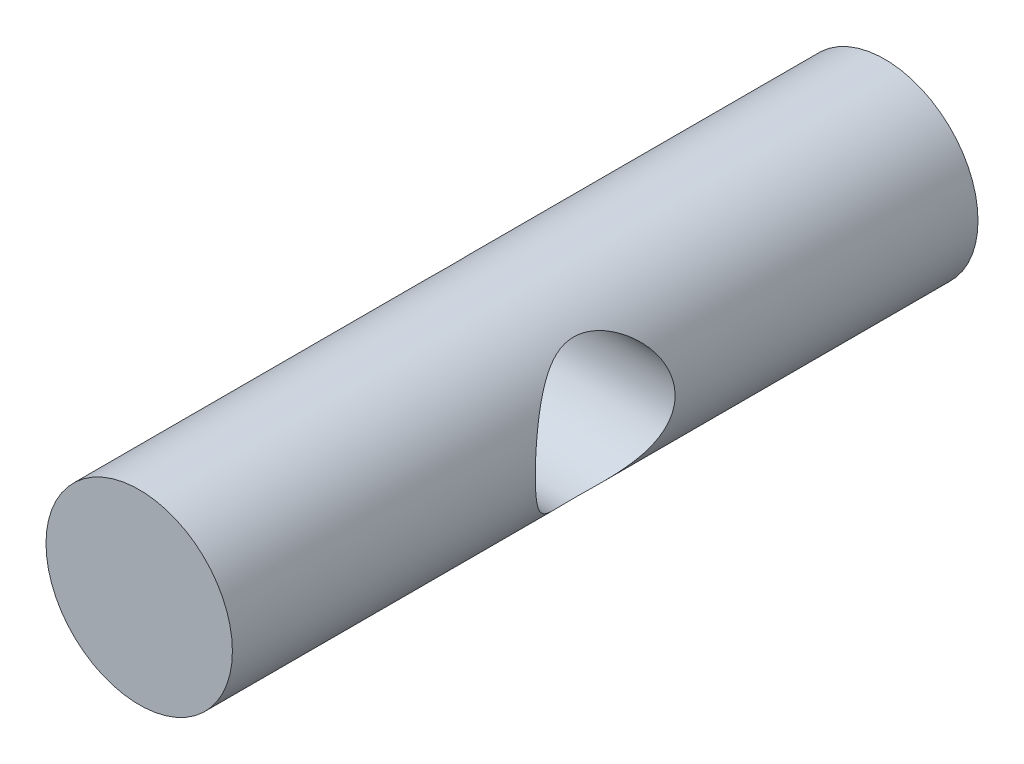
from build123d import *

# Parameters (mm, degrees)
SKETCH1_R               = 10
BOSS_EXTRUDE1_DEPTH     = 80
CUT_EXTRUDE1_DEPTH      = 13
CUT_EXTRUDE1_DEPTH_BACK = 14
SKETCH2_R               = 7.5


with BuildPart() as part:
    # Sketch1 → Boss-Extrude1 (new body)
    with BuildSketch(Plane.XY):
        Circle(SKETCH1_R)
    extrude(amount=BOSS_EXTRUDE1_DEPTH)

    # Sketch2 → Cut-Extrude1 (cut, two sides: drawn at the far end of the back side and taken through both)
    with BuildSketch(Plane(origin=(0, 0, 0), x_dir=(0, 0, -1), z_dir=(1, 0, 0)).offset(-CUT_EXTRUDE1_DEPTH_BACK)):
        with Locations(Location((-40, 0, 0), (0, 0, 180))):
            Circle(SKETCH2_R)
    extrude(amount=CUT_EXTRUDE1_DEPTH + CUT_EXTRUDE1_DEPTH_BACK, mode=Mode.SUBTRACT)


solid = part.part
